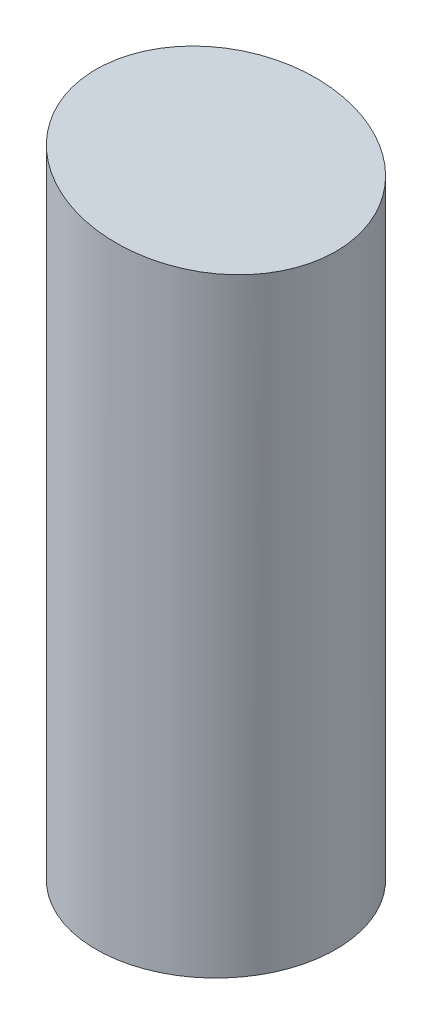
from build123d import *

# Parameters (mm, degrees)
CROQUIS1_R              = 31.75
SALIENTE_EXTRUIR1_DEPTH = 170
CORTAR_EXTRUIR1_DEPTH   = 90
SALIENTE_EXTRUIR2_DEPTH = 8


with BuildPart() as part:
    # Croquis1 → Saliente-Extruir1 (new body)
    with BuildSketch(Plane(origin=(0, 0, 0), x_dir=(1, 0, 0), z_dir=(0, 1, 0))):
        with Locations(Location((0, 0, 0), (0, 0, 270))):
            Circle(CROQUIS1_R)
    extrude(amount=SALIENTE_EXTRUIR1_DEPTH)

    # Croquis2 → Cortar-Extruir1 (cut, symmetric)
    with BuildSketch(Plane.XY):
        Polygon((-31.75, 170), (31.75, 160), (31.75, 170), align=None)
    extrude(amount=CORTAR_EXTRUIR1_DEPTH, both=True, mode=Mode.SUBTRACT)

    # Croquis3 → Saliente-Extruir2 (add)
    with BuildSketch(Plane.XZ):
        Polygon((-31.75, 0), (-31.75, 2), (-28.75, 2), (-28.75, -2), (-31.75, -2), align=None)
    extrude(amount=-SALIENTE_EXTRUIR2_DEPTH)


solid = part.part
